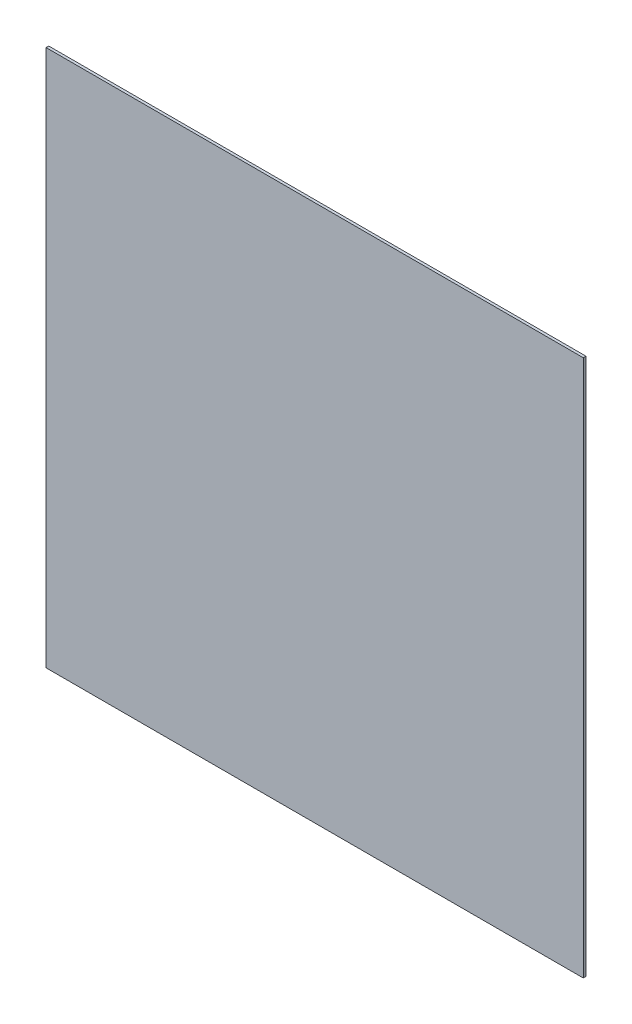
from build123d import *

# Parameters (mm, degrees)
SKIZZE1_W                       = 800
SKIZZE1_H                       = 800
AUFSATZ_LINEAR_AUSTRAGEN1_DEPTH = 4


with BuildPart() as part:
    # Skizze1 → Aufsatz-Linear austragen1 (new body)
    with BuildSketch(Plane.XY):
        Rectangle(SKIZZE1_W, SKIZZE1_H)
    extrude(amount=AUFSATZ_LINEAR_AUSTRAGEN1_DEPTH)


solid = part.part
